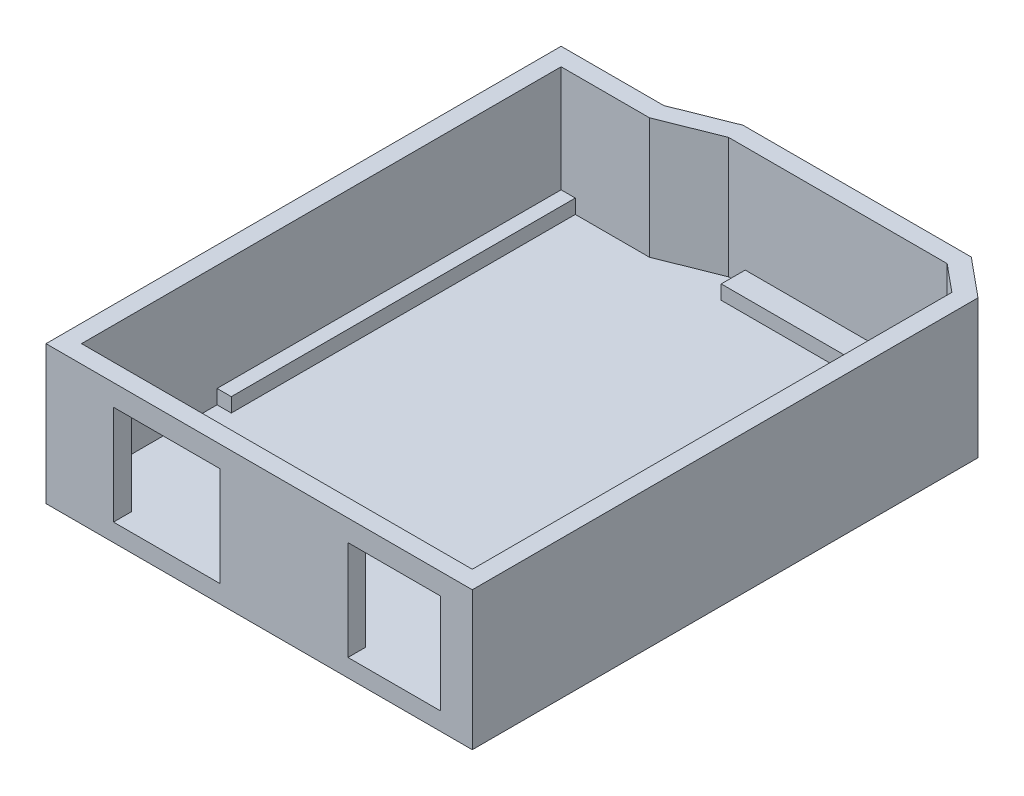
from build123d import *

# Parameters (mm, degrees)
BOSS_EXTRUDE1_DEPTH = 17
SHELL1_T            = 2.5
SKETCH2_W           = 15
SKETCH2_H           = 14
SKETCH2_W_2         = 13
CUT_EXTRUDE1_DEPTH  = 4
SKETCH3_W           = 2
SKETCH3_H           = 50
BOSS_EXTRUDE2_DEPTH = 2
SKETCH4_W           = 26.147040262
SKETCH4_H           = 3.374772828
BOSS_EXTRUDE3_DEPTH = 2


with BuildPart() as part:
    # Sketch1 → Boss-Extrude1 (new body)
    with BuildSketch(Plane(origin=(0, 0, 0), x_dir=(1, 0, 0), z_dir=(0, 1, 0))):
        Polygon((0, 0), (0, 67.5), (12.433659819, 67.5), (20.392796314, 70.676839536), (51.157808577, 70.676839536), (55, 67.5), (55, 0), align=None)
    extrude(amount=BOSS_EXTRUDE1_DEPTH)

    # Shell1
    shell1_openings = [part.faces().sort_by_distance(p)[0] for p in [
        (27.718752105, 17, -34.822433689),
    ]]
    offset(amount=SHELL1_T, openings=shell1_openings, kind=Kind.INTERSECTION)

    # Sketch2 → Cut-Extrude1 (cut)
    with BuildSketch(Plane(origin=(0, 0, 0), x_dir=(-1, 0, 0), z_dir=(0, 0, -1))):
        with Locations((-14.5, 7)):
            Rectangle(SKETCH2_W, SKETCH2_H)
        with Locations((-46.5, 7)):
            Rectangle(SKETCH2_W_2, SKETCH2_H)
    extrude(amount=-CUT_EXTRUDE1_DEPTH, mode=Mode.SUBTRACT)

    # Sketch3 → Boss-Extrude2 (add)
    with BuildSketch(Plane(origin=(0, 0, 0), x_dir=(1, 0, 0), z_dir=(0, 1, 0))):
        with Locations((1, 44.078139118)):
            Rectangle(SKETCH3_W, SKETCH3_H)
        with Locations((54, 44.078139118)):
            Rectangle(SKETCH3_W, SKETCH3_H)
    extrude(amount=BOSS_EXTRUDE2_DEPTH)

    # Sketch4 → Boss-Extrude3 (add)
    with BuildSketch(Plane(origin=(0, 0, 0), x_dir=(1, 0, 0), z_dir=(0, 1, 0))):
        with Locations((35.808300775, 68.989453122)):
            Rectangle(SKETCH4_W, SKETCH4_H)
    extrude(amount=BOSS_EXTRUDE3_DEPTH)


solid = part.part
